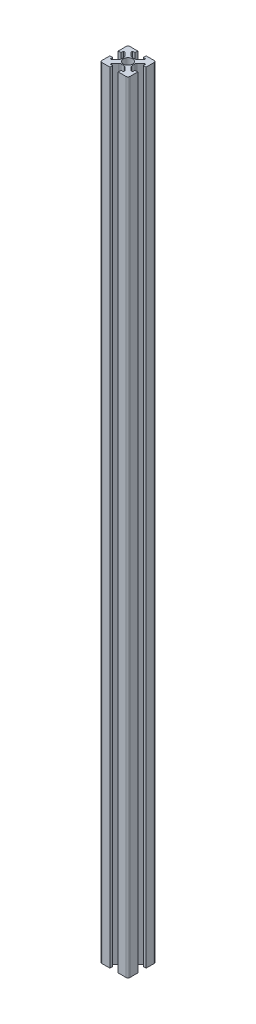
from build123d import *

# Parameters (mm, degrees)
BOSS_EXTRUDE1_DEPTH     = 420
CUT_EXTRUDE1_DEPTH      = 421.133907225
CUT_EXTRUDE1_DEPTH_BACK = 421.133907225
SKETCH3_R               = 2.5


with BuildPart() as part:
    # Sketch1 → Boss-Extrude1 (new body)
    with BuildSketch(Plane(origin=(0, 0, 0), x_dir=(1, 0, 0), z_dir=(0, 1, 0))):
        with BuildLine():
            Line((-6.5, 7.5), (-2.25, 7.5))
            Line((-2.25, 7.5), (-2.25, 6))
            Line((-2.25, 6), (-3.552594335, 6))
            Line((-3.552594335, 6), (-3.552594335, 5.280183676))
            Line((-3.552594335, 5.280183676), (-1.60191553, 3.329504871))
            ThreePointArc((-1.60191553, 3.329504871), (-1.236939263, 3.085635526), (-0.806420401, 3))
            Line((-0.806420401, 3), (0.806420401, 3))
            ThreePointArc((0.806420401, 3), (1.236939263, 3.085635526), (1.60191553, 3.329504871))
            Line((1.60191553, 3.329504871), (3.552594335, 5.280183676))
            Line((3.552594335, 5.280183676), (3.552594335, 6))
            Line((3.552594335, 6), (2.25, 6))
            Line((2.25, 6), (2.25, 7.5))
            Line((2.25, 7.5), (6.5, 7.5))
            ThreePointArc((6.5, 7.5), (7.207106781, 7.207106781), (7.5, 6.5))
            Line((7.5, 6.5), (7.5, 2.25))
            Line((7.5, 2.25), (6, 2.25))
            Line((6, 2.25), (6, 3.552594335))
            Line((6, 3.552594335), (5.280183676, 3.552594335))
            Line((5.280183676, 3.552594335), (3.329504871, 1.60191553))
            ThreePointArc((3.329504871, 1.60191553), (3.085635526, 1.236939263), (3, 0.806420401))
            Line((3, 0.806420401), (3, -0.806420401))
            ThreePointArc((3, -0.806420401), (3.085635526, -1.236939263), (3.329504871, -1.60191553))
            Line((3.329504871, -1.60191553), (5.280183676, -3.552594335))
            Line((5.280183676, -3.552594335), (6, -3.552594335))
            Line((6, -3.552594335), (6, -2.25))
            Line((6, -2.25), (7.5, -2.25))
            Line((7.5, -2.25), (7.5, -6.5))
            ThreePointArc((7.5, -6.5), (7.207106781, -7.207106781), (6.5, -7.5))
            Line((6.5, -7.5), (2.25, -7.5))
            Line((2.25, -7.5), (2.25, -6))
            Line((2.25, -6), (3.552594335, -6))
            Line((3.552594335, -6), (3.552594335, -5.280183676))
            Line((3.552594335, -5.280183676), (1.60191553, -3.329504871))
            ThreePointArc((1.60191553, -3.329504871), (1.236939263, -3.085635526), (0.806420401, -3))
            Line((0.806420401, -3), (-0.806420401, -3))
            ThreePointArc((-0.806420401, -3), (-1.236939263, -3.085635526), (-1.60191553, -3.329504871))
            Line((-1.60191553, -3.329504871), (-3.552594335, -5.280183676))
            Line((-3.552594335, -5.280183676), (-3.552594335, -6))
            Line((-3.552594335, -6), (-2.25, -6))
            Line((-2.25, -6), (-2.25, -7.5))
            Line((-2.25, -7.5), (-6.5, -7.5))
            ThreePointArc((-6.5, -7.5), (-7.207106781, -7.207106781), (-7.5, -6.5))
            Line((-7.5, -6.5), (-7.5, -2.25))
            Line((-7.5, -2.25), (-6, -2.25))
            Line((-6, -2.25), (-6, -3.552594335))
            Line((-6, -3.552594335), (-5.280183676, -3.552594335))
            Line((-5.280183676, -3.552594335), (-3.329504871, -1.60191553))
            ThreePointArc((-3.329504871, -1.60191553), (-3.085635526, -1.236939263), (-3, -0.806420401))
            Line((-3, -0.806420401), (-3, 0.806420401))
            ThreePointArc((-3, 0.806420401), (-3.085635526, 1.236939263), (-3.329504871, 1.60191553))
            Line((-3.329504871, 1.60191553), (-5.280183676, 3.552594335))
            Line((-5.280183676, 3.552594335), (-6, 3.552594335))
            Line((-6, 3.552594335), (-6, 2.25))
            Line((-6, 2.25), (-7.5, 2.25))
            Line((-7.5, 2.25), (-7.5, 6.5))
            ThreePointArc((-7.5, 6.5), (-7.207106781, 7.207106781), (-6.5, 7.5))
        make_face()
    extrude(amount=BOSS_EXTRUDE1_DEPTH)

    # Sketch3 → Cut-Extrude1 (cut, two sides: drawn at the far end of the back side and taken through both)
    with BuildSketch(Plane(origin=(0, 420, 0), x_dir=(1, 0, 0), z_dir=(0, 1, 0)).offset(-CUT_EXTRUDE1_DEPTH_BACK)):
        with Locations(Location((0, 0, 0), (0, 0, 270))):
            Circle(SKETCH3_R)
    extrude(amount=CUT_EXTRUDE1_DEPTH + CUT_EXTRUDE1_DEPTH_BACK, mode=Mode.SUBTRACT)


solid = part.part
